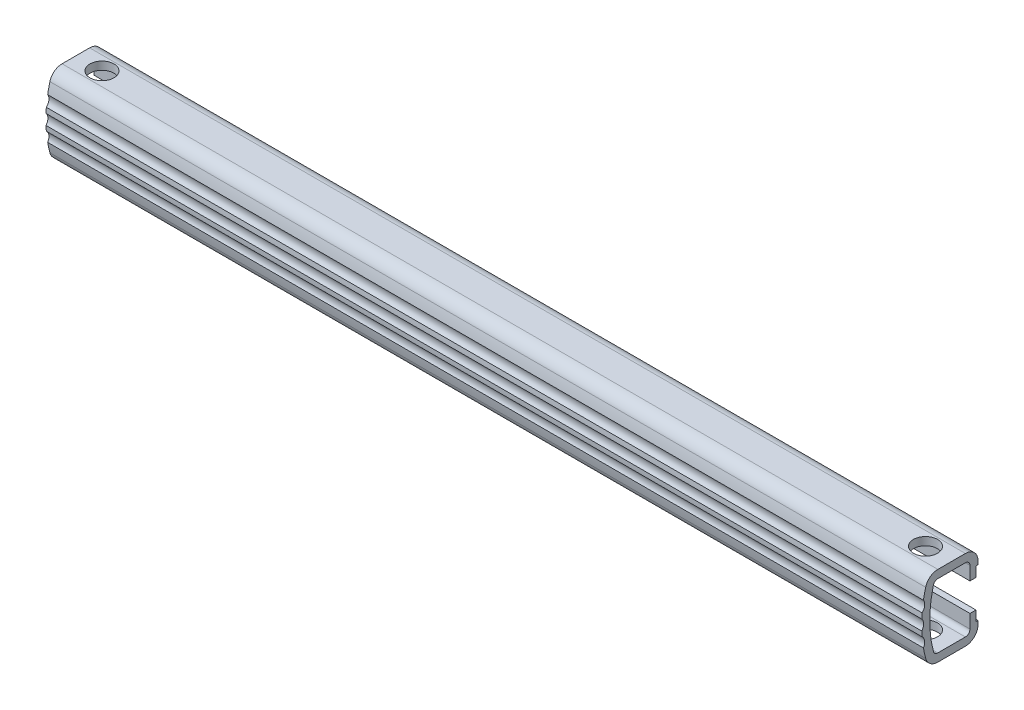
from build123d import *

# Parameters (mm, degrees)
EXTRUDE1_DEPTH          = 54.5
CUT_EXTRUDE1_DEPTH      = 55.854885702
CUT_EXTRUDE1_DEPTH_BACK = 55.854885702
SKETCH2_R               = 1.5
CUT_EXTRUDE2_DEPTH      = 55.854885702
CUT_EXTRUDE2_DEPTH_BACK = 55.854885702


with BuildPart() as part:
    # Sketch1 → Extrude1 (new, symmetric)
    with BuildSketch(Plane(origin=(0, 0, 0), x_dir=(0, 0, -1), z_dir=(1, 0, 0))):
        with BuildLine():
            Line((-1.715977045, 5), (1.715977045, 5))
            ThreePointArc((1.715977045, 5), (2.824752941, 4.540729986), (3.284022955, 3.43195409))
            Line((3.284022955, 3.43195409), (3.284022955, -3.43195409))
            ThreePointArc((3.284022955, -3.43195409), (2.824752941, -4.540729986), (1.715977045, -5))
            Line((1.715977045, -5), (-1.715977045, -5))
            ThreePointArc((-1.715977045, -5), (-2.672673527, -4.674330771), (-3.23197526, -3.832600305))
            ThreePointArc((-3.23197526, -3.832600305), (-3.383560587, -3.204564402), (-3.507961213, -2.570583572))
            ThreePointArc((-3.507961213, -2.570583572), (-3.356955711, -1.900195953), (-3.674237451, -1.290643232))
            ThreePointArc((-3.674237451, -1.290643232), (-3.698584955, -0.968220458), (-3.715977045, -0.645347786))
            ThreePointArc((-3.715977045, -0.645347786), (-3.479865934, 0), (-3.715977045, 0.645347786))
            ThreePointArc((-3.715977045, 0.645347786), (-3.698584955, 0.968220458), (-3.674237451, 1.290643232))
            ThreePointArc((-3.674237451, 1.290643232), (-3.356955711, 1.900195953), (-3.507961213, 2.570583572))
            ThreePointArc((-3.507961213, 2.570583572), (-3.383560587, 3.204564402), (-3.23197526, 3.832600305))
            ThreePointArc((-3.23197526, 3.832600305), (-2.672673527, 4.674330771), (-1.715977045, 5))
        make_face()
        with BuildLine():
            Line((-1.715977045, 4), (1.715977045, 4))
            ThreePointArc((1.715977045, 4), (2.11764616, 3.833623205), (2.284022955, 3.43195409))
            Line((2.284022955, 3.43195409), (2.284022955, -3.43195409))
            ThreePointArc((2.284022955, -3.43195409), (2.11764616, -3.833623205), (1.715977045, -4))
            Line((1.715977045, -4), (-1.715977045, -4))
            ThreePointArc((-1.715977045, -4), (-2.062553328, -3.882021902), (-2.265167971, -3.577093618))
            ThreePointArc((-2.265167971, -3.577093618), (-2.729865934, 0), (-2.265167971, 3.577093618))
            ThreePointArc((-2.265167971, 3.577093618), (-2.062553328, 3.882021902), (-1.715977045, 4))
        make_face(mode=Mode.SUBTRACT)
    extrude(amount=EXTRUDE1_DEPTH, both=True)

    # Sketch2 → Cut-Extrude1 (cut, two sides: drawn at the far end of the back side and taken through both)
    with BuildSketch(Plane(origin=(0, 0, 0), x_dir=(1, 0, 0), z_dir=(0, 1, 0)).offset(-CUT_EXTRUDE1_DEPTH_BACK)):
        with Locations(Location((-51.25, 0, 0), (0, 0, 270))):
            Circle(SKETCH2_R)
        with Locations(Location((51.25, 0, 0), (0, 0, 90))):
            Circle(SKETCH2_R)
    extrude(amount=CUT_EXTRUDE1_DEPTH + CUT_EXTRUDE1_DEPTH_BACK, mode=Mode.SUBTRACT)

    # Sketch3 → Cut-Extrude2 (cut, two sides: drawn at the far end of the back side and taken through both)
    with BuildSketch(Plane(origin=(0, 0, 0), x_dir=(0, 0, -1), z_dir=(1, 0, 0)).offset(-CUT_EXTRUDE2_DEPTH_BACK)):
        Polygon((0, -1.75), (0, 1.75), (3.034022955, 1.75), (3.034022955, 3), (4.284022955, 3), (4.284022955, -3), (3.034022955, -3), (3.034022955, -1.75), align=None)
    extrude(amount=CUT_EXTRUDE2_DEPTH + CUT_EXTRUDE2_DEPTH_BACK, mode=Mode.SUBTRACT)


solid = part.part
